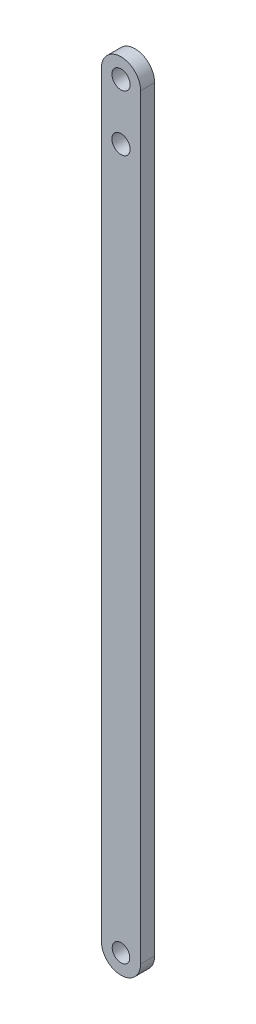
from build123d import *

# Parameters (mm, degrees)
SKETCH1_R           = 3.130555183
BOSS_EXTRUDE1_DEPTH = 5
SKETCH2_R           = 3.25
CUT_EXTRUDE1_DEPTH  = 10


with BuildPart() as part:
    # Sketch1 → Boss-Extrude1 (new body)
    with BuildSketch(Plane.XY):
        with BuildLine():
            Line((7, 270), (7, 0))
            ThreePointArc((7, 0), (0, -7), (-7, 0))
            Line((-7, 0), (-7, 270))
            ThreePointArc((-7, 270), (0, 277), (7, 270))
        make_face()
        Circle(SKETCH1_R, mode=Mode.SUBTRACT)
    extrude(amount=BOSS_EXTRUDE1_DEPTH)

    # Sketch2 → Cut-Extrude1 (cut)
    with BuildSketch(Plane.XY.offset(5)):
        with Locations((0, 270)):
            Circle(SKETCH2_R)
        with Locations((0, 250)):
            Circle(SKETCH2_R)
    extrude(amount=-CUT_EXTRUDE1_DEPTH, mode=Mode.SUBTRACT)


solid = part.part
